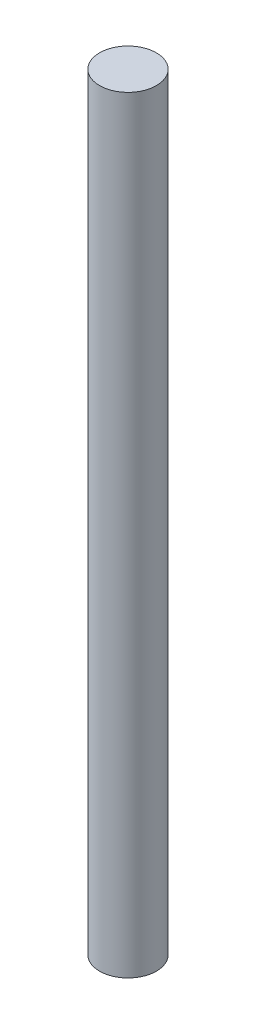
from build123d import *

# Parameters (mm, degrees)
SKETCH1_R           = 11.1125
BOSS_EXTRUDE1_DEPTH = 300


with BuildPart() as part:
    # Sketch1 → Boss-Extrude1 (new body)
    with BuildSketch(Plane(origin=(0, 0, 0), x_dir=(1, 0, 0), z_dir=(0, 1, 0))):
        with Locations(Location((0, 0, 0), (0, 0, 270))):
            Circle(SKETCH1_R)
    extrude(amount=BOSS_EXTRUDE1_DEPTH)


solid = part.part
